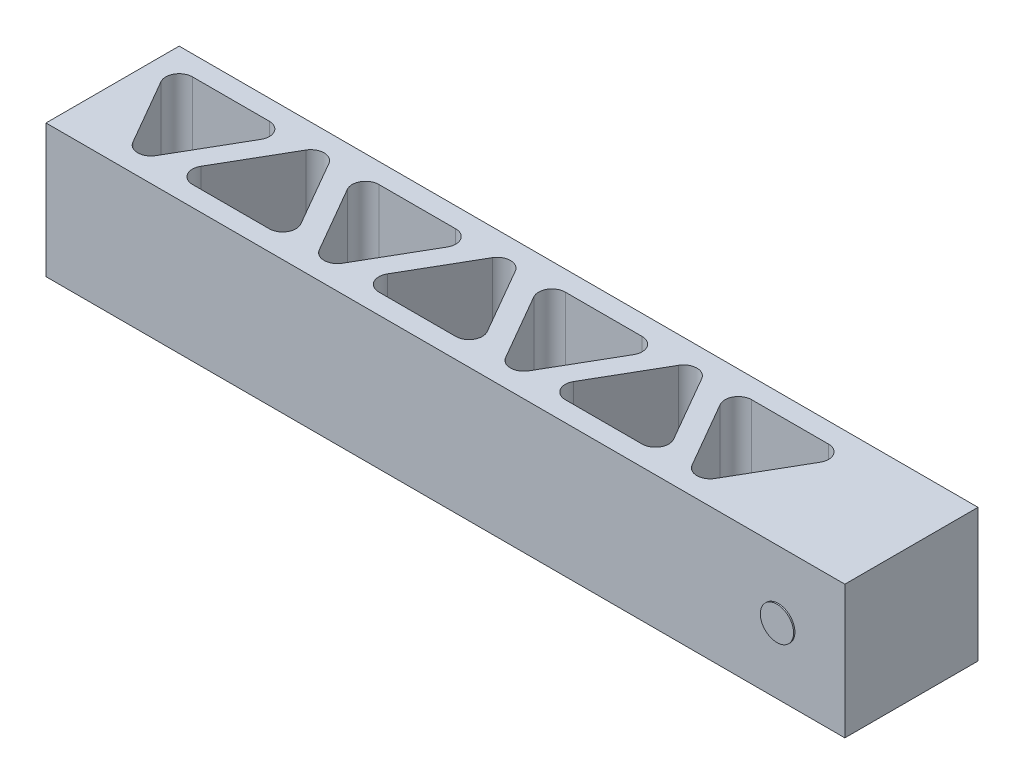
from build123d import *

# Parameters (mm, degrees)
SKETCH5_W                = 120
SKETCH5_H                = 20
BOSS_EXTRUDE1_DEPTH      = 20
BOSS_EXTRUDE2_DEPTH      = 0.2
BOSS_EXTRUDE2_DEPTH_BACK = 20.2
SKETCH7_R                = 2.5
CUT_EXTRUDE1_DEPTH       = 124.320882254
BODY_MOVE_COPY1_ANGLE    = 90


with BuildPart() as part:
    # Sketch5 → Boss-Extrude1 (new body)
    with BuildSketch(Plane.XY):
        with Locations((60, 10)):
            Rectangle(SKETCH5_W, SKETCH5_H)
    extrude(amount=BOSS_EXTRUDE1_DEPTH)

    # Sketch7 → Boss-Extrude2 (add, two sides: drawn at the far end of the back side and taken through both)
    with BuildSketch(Plane(origin=(0, 20, 0), x_dir=(1, 0, 0), z_dir=(0, 1, 0)).offset(-BOSS_EXTRUDE2_DEPTH_BACK)):
        with Locations(Location((110, -10, 0), (0, 0, 270))):
            Circle(SKETCH7_R)
    extrude(amount=BOSS_EXTRUDE2_DEPTH + BOSS_EXTRUDE2_DEPTH_BACK)

    # Sketch6 → Cut-Extrude1 (cut, through all)
    with BuildSketch(Plane.XY.offset(20)):
        with BuildLine():
            Line((54.505553499, 4), (60.279056191, 14))
            ThreePointArc((60.279056191, 14), (60.279056191, 16), (58.547005384, 17))
            Line((58.547005384, 17), (47, 17))
            ThreePointArc((47, 17), (45.267949192, 16), (45.267949192, 14))
            Line((45.267949192, 14), (51.041451884, 4))
            ThreePointArc((51.041451884, 4), (52.773502692, 3), (54.505553499, 4))
        make_face()
        with BuildLine():
            Line((5, 3), (16.547005384, 3))
            ThreePointArc((16.547005384, 3), (18.279056191, 4), (18.279056191, 6))
            Line((18.279056191, 6), (12.505553499, 16))
            ThreePointArc((12.505553499, 16), (10.773502692, 17), (9.041451884, 16))
            Line((9.041451884, 16), (3.267949192, 6))
            ThreePointArc((3.267949192, 6), (3.267949192, 4), (5, 3))
        make_face()
        with BuildLine():
            Line((26.505553499, 4), (32.279056191, 14))
            ThreePointArc((32.279056191, 14), (32.279056191, 16), (30.547005384, 17))
            Line((30.547005384, 17), (19, 17))
            ThreePointArc((19, 17), (17.267949192, 16), (17.267949192, 14))
            Line((17.267949192, 14), (23.041451884, 4))
            ThreePointArc((23.041451884, 4), (24.773502692, 3), (26.505553499, 4))
        make_face()
        with BuildLine():
            Line((37.041451884, 16), (31.267949192, 6))
            ThreePointArc((31.267949192, 6), (31.267949192, 4), (33, 3))
            Line((33, 3), (44.547005384, 3))
            ThreePointArc((44.547005384, 3), (46.279056191, 4), (46.279056191, 6))
            Line((46.279056191, 6), (40.505553499, 16))
            ThreePointArc((40.505553499, 16), (38.773502692, 17), (37.041451884, 16))
        make_face()
        with BuildLine():
            Line((65.041451884, 16), (59.267949192, 6))
            ThreePointArc((59.267949192, 6), (59.267949192, 4), (61, 3))
            Line((61, 3), (72.547005384, 3))
            ThreePointArc((72.547005384, 3), (74.279056191, 4), (74.279056191, 6))
            Line((74.279056191, 6), (68.505553499, 16))
            ThreePointArc((68.505553499, 16), (66.773502692, 17), (65.041451884, 16))
        make_face()
        with BuildLine():
            Line((93.041451884, 16), (87.267949192, 6))
            ThreePointArc((87.267949192, 6), (87.267949192, 4), (89, 3))
            Line((89, 3), (100.547005384, 3))
            ThreePointArc((100.547005384, 3), (102.279056191, 4), (102.279056191, 6))
            Line((102.279056191, 6), (96.505553499, 16))
            ThreePointArc((96.505553499, 16), (94.773502692, 17), (93.041451884, 16))
        make_face()
        with BuildLine():
            Line((82.505553499, 4), (88.279056191, 14))
            ThreePointArc((88.279056191, 14), (88.279056191, 16), (86.547005384, 17))
            Line((86.547005384, 17), (75, 17))
            ThreePointArc((75, 17), (73.267949192, 16), (73.267949192, 14))
            Line((73.267949192, 14), (79.041451884, 4))
            ThreePointArc((79.041451884, 4), (80.773502692, 3), (82.505553499, 4))
        make_face()
    extrude(amount=-CUT_EXTRUDE1_DEPTH, mode=Mode.SUBTRACT)


with BuildPart() as part_1:
    # Body-Move/Copy1: moved
    add(part.part.rotate(Axis((0, 7.5, 7.5), (1, 0, 0)), BODY_MOVE_COPY1_ANGLE))


solid = part_1.part
